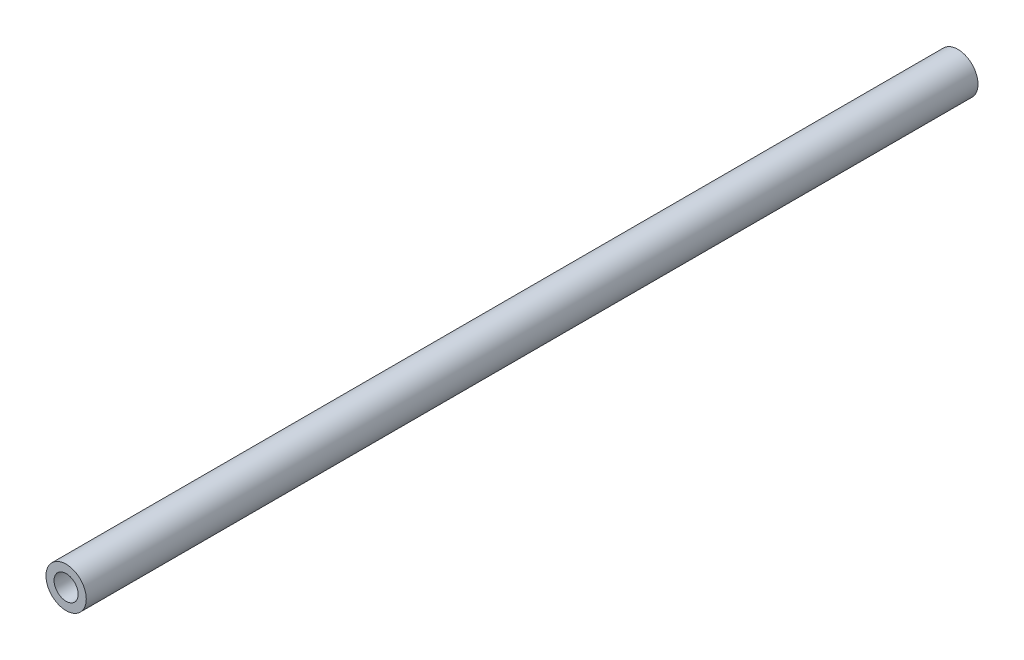
from build123d import *

# Parameters (mm, degrees)
SKETCH1_R           = 3.175
SKETCH1_R_2         = 1.89865
BOSS_EXTRUDE1_DEPTH = 140.49375


with BuildPart() as part:
    # Sketch1 → Boss-Extrude1 (new body)
    with BuildSketch(Plane.XY):
        Circle(SKETCH1_R)
        Circle(SKETCH1_R_2, mode=Mode.SUBTRACT)
    extrude(amount=BOSS_EXTRUDE1_DEPTH)


solid = part.part
